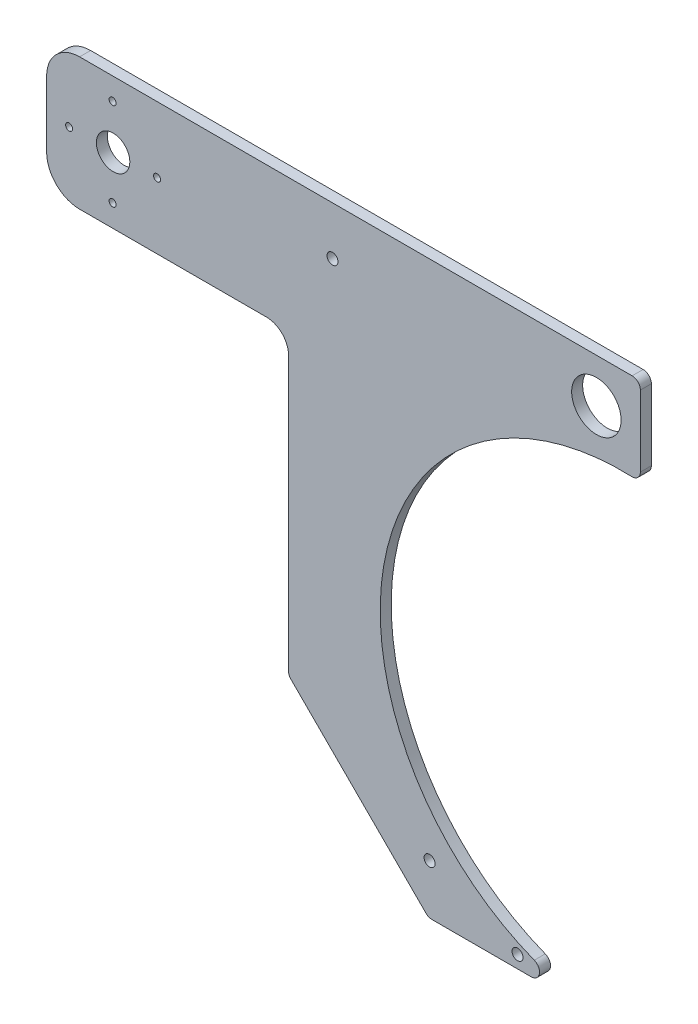
from build123d import *

# Parameters (mm, degrees)
SKETCH1_R           = 14.2875
SKETCH1_R_2         = 3.175
SKETCH1_R_3         = 9.652
SKETCH1_R_4         = 2.032
BOSS_EXTRUDE3_DEPTH = 6.35


with BuildPart() as part:
    # Sketch1 → Boss-Extrude3 (new body)
    with BuildSketch(Plane.XY):
        with BuildLine():
            Line((0, 1.972692091), (0, 160.02))
            ThreePointArc((0, 160.02), (-3.719743879, 169.000256121), (-12.7, 172.72))
            Line((-12.7, 172.72), (-101.6, 172.72))
            Line((-101.6, 172.72), (-120.65, 172.72))
            ThreePointArc((-120.65, 172.72), (-134.120384182, 178.299615818), (-139.7, 191.77))
            Line((-139.7, 191.77), (-139.7, 229.87))
            ThreePointArc((-139.7, 229.87), (-134.120384182, 243.340384182), (-120.65, 248.92))
            Line((-120.65, 248.92), (-101.6, 248.92))
            Line((-101.6, 248.92), (0, 248.92))
            Line((0, 248.92), (4.7625, 248.92))
            Line((4.7625, 248.92), (198.4375, 248.92))
            ThreePointArc((198.4375, 248.92), (201.805096045, 247.525096045), (203.2, 244.1575))
            Line((203.2, 244.1575), (203.2, 203.159397936))
            ThreePointArc((203.2, 203.159397936), (201.73893916, 199.726919863), (198.252218068, 198.400503437))
            ThreePointArc((198.252218068, 198.400503437), (55.900468813, 87.207475286), (141.92702513, -71.623698082))
            ThreePointArc((141.92702513, -71.623698082), (144.874483412, -76.941407786), (140.194292932, -80.82230509))
            Line((140.194292932, -80.82230509), (82.79499718, -80.82230509))
            ThreePointArc((82.79499718, -80.82230509), (80.972467334, -80.459781363), (79.427401135, -79.427401135))
            Line((79.427401135, -79.427401135), (1.394903955, -1.394903955))
            ThreePointArc((1.394903955, -1.394903955), (0.362523726, 0.150162244), (0, 1.972692091))
        make_face()
        with Locations((177.8, 223.52)):
            Circle(SKETCH1_R, mode=Mode.SUBTRACT)
        with Locations((132.256792932, -73.51980509)):
            Circle(SKETCH1_R_2, mode=Mode.SUBTRACT)
        with Locations((81.456792932, -52.06873783)):
            Circle(SKETCH1_R_2, mode=Mode.SUBTRACT)
        with Locations((25.4, 220.98)):
            Circle(SKETCH1_R_2, mode=Mode.SUBTRACT)
        with Locations((-101.311264174, 210.821094089)):
            Circle(SKETCH1_R_3, mode=Mode.SUBTRACT)
        with Locations((-75.911264174, 210.821094089)):
            Circle(SKETCH1_R_4, mode=Mode.SUBTRACT)
        with Locations((-126.711264174, 210.821094089)):
            Circle(SKETCH1_R_4, mode=Mode.SUBTRACT)
        with Locations((-101.6, 236.221094089)):
            Circle(SKETCH1_R_4, mode=Mode.SUBTRACT)
        with Locations((-101.6, 185.421094089)):
            Circle(SKETCH1_R_4, mode=Mode.SUBTRACT)
    extrude(amount=BOSS_EXTRUDE3_DEPTH)


solid = part.part
